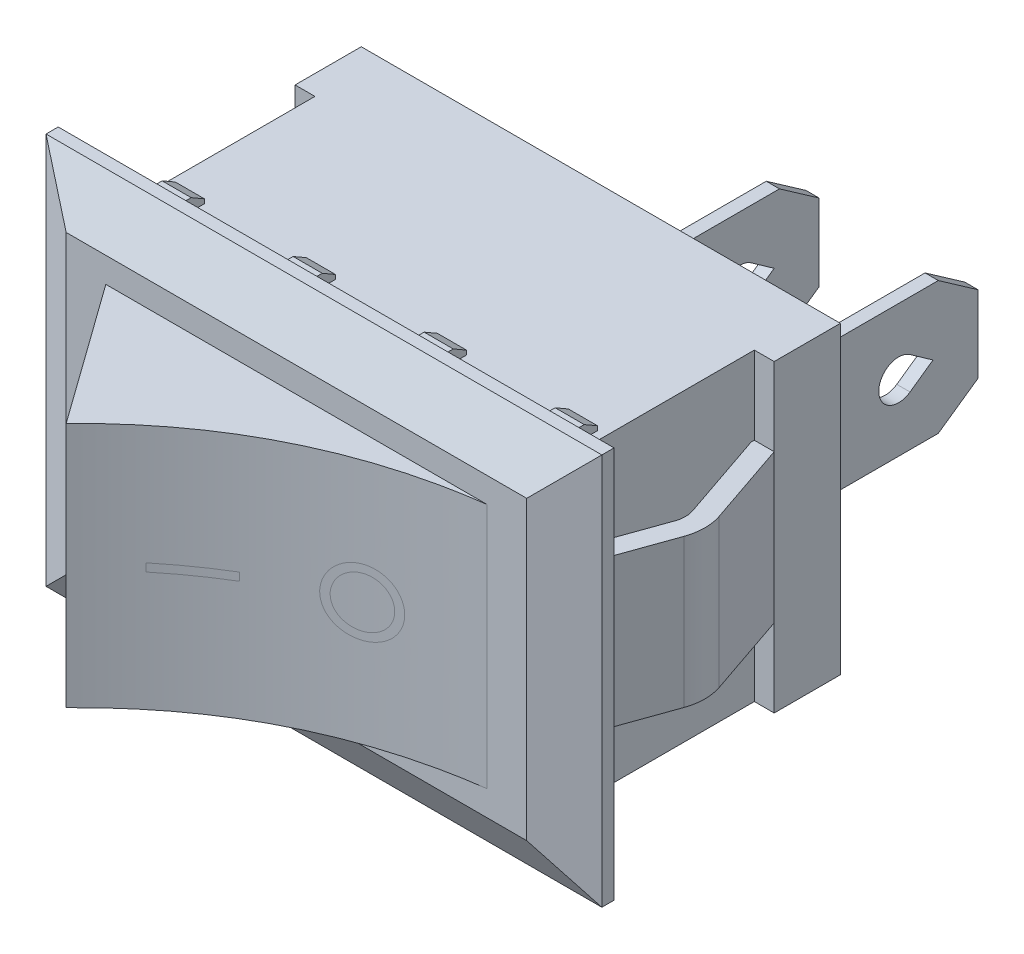
from build123d import *
from OCP.BRepFilletAPI import BRepFilletAPI_MakeChamfer

# Parameters (mm, degrees)
SKETCH1_W                       = 16.6
SKETCH1_H                       = 11.5
BOSS_EXTRUDE1_DEPTH             = 10
SKETCH2_W                       = 21
SKETCH2_H                       = 14.8
BOSS_EXTRUDE2_DEPTH             = 1.5
SKETCH3_W                       = 0.5
SKETCH3_H                       = 5
BOSS_EXTRUDE3_DEPTH             = 8
SKETCH4_W                       = 0.5
SKETCH4_H                       = 0.4
CUT_EXTRUDE1_DEPTH              = 22.623424798
BOSS_EXTRUDE4_REACH             = 19.241
SKETCH5_W                       = 0.75
SKETCH5_H                       = 2.5
BOSS_EXTRUDE4_DIRECTION_2_REACH = 19.241
BOSS_EXTRUDE5_DEPTH             = 2.8
BOSS_EXTRUDE5_DEPTH_BACK        = 2.8
CHAMFER1_SIZE                   = 1.8
CHAMFER1_SIZE2                  = 1.039230485
BOSS_EXTRUDE6_DEPTH             = 4.65
SKETCH9_W                       = 1.1
SKETCH9_H                       = 0.45
BOSS_EXTRUDE7_DEPTH             = 1.9
CHAMFER2_SIZE                   = 0.5
CHAMFER2_SIZE2                  = 0.288675135
SCALE2_SCALE                    = 0.7


with BuildPart() as part:
    # Sketch1 → Boss-Extrude1 (new body)
    with BuildSketch(Plane.XY):
        Rectangle(SKETCH1_W, SKETCH1_H)
    extrude(amount=BOSS_EXTRUDE1_DEPTH)

    # Sketch2 → Boss-Extrude2 (add)
    with BuildSketch(Plane.XY.offset(10)):
        Rectangle(SKETCH2_W, SKETCH2_H)
    extrude(amount=BOSS_EXTRUDE2_DEPTH)

    # Sketch3 → Boss-Extrude3 (add)
    with BuildSketch(Plane(origin=(0, 0, 0), x_dir=(-1, 0, 0), z_dir=(0, 0, -1))):
        with Locations((-6, 0)):
            Rectangle(SKETCH3_W, SKETCH3_H)
        Rectangle(SKETCH3_W, SKETCH3_H)
    extrude(amount=BOSS_EXTRUDE3_DEPTH)

    # Sketch4 → Cut-Extrude1 (cut, through all)
    with BuildSketch(Plane(origin=(6.25, 0, 0), x_dir=(0, 0, -1), z_dir=(1, 0, 0))):
        with Locations((2.25, 2.3)):
            Rectangle(SKETCH4_W, SKETCH4_H)
        with BuildLine():
            Line((0, 0.75), (0, -0.75))
            ThreePointArc((0, -0.75), (0.75, 0), (0, 0.75))
        make_face()
        Polygon((6.5, 2.5), (8, 1.449688693), (8, 2.5), align=None)
        with BuildLine():
            Line((5.432692308, 0.612598863), (6.3, 0))
            Line((6.3, 0), (5.432692308, -0.612598863))
            ThreePointArc((5.432692308, -0.612598863), (4.25, 0), (5.432692308, 0.612598863))
        make_face()
        Polygon((8, -2.5), (8, -1.449688693), (6.5, -2.5), align=None)
        with Locations((2.25, -2.3)):
            Rectangle(SKETCH4_W, SKETCH4_H)
    extrude(amount=-CUT_EXTRUDE1_DEPTH, mode=Mode.SUBTRACT)

    # Boss-Extrude4: up to this face of the body (flat: up to its plane)
    boss_extrude4_end = Plane(part.part.faces().sort_by_distance((0, 5.75, 5))[0])
    # Sketch5 → Boss-Extrude4 (add, up to the picked face)
    with BuildSketch(Plane(origin=(0, 0, 0), x_dir=(1, 0, 0), z_dir=(0, 1, 0)), mode=Mode.PRIVATE) as boss_extrude4_sk1:
        with Locations((-8.675, -1.25)):
            Rectangle(SKETCH5_W, SKETCH5_H)
    boss_extrude4_tool1 = split(extrude(boss_extrude4_sk1.sketch, amount=BOSS_EXTRUDE4_REACH, mode=Mode.PRIVATE), bisect_by=boss_extrude4_end, keep=Keep.BOTH, mode=Mode.PRIVATE)
    boss_extrude4 = boss_extrude4_tool1.solids().sort_by(Axis((-8.675, 0, 1.25), (0, 1, 0)))[0]
    add(boss_extrude4)

    # Boss-Extrude4 direction 2: up to this face of the body (flat: up to its plane)
    boss_extrude4_direction_2_end = Plane(part.part.faces().sort_by_distance((0, -5.75, 5))[0])
    # Sketch5 → Boss-Extrude4 direction 2 (add, up to the picked face)
    with BuildSketch(Plane(origin=(0, 0, 0), x_dir=(1, 0, 0), z_dir=(0, 1, 0)), mode=Mode.PRIVATE) as boss_extrude4_direction_2_sk1:
        with Locations((-8.675, -1.25)):
            Rectangle(SKETCH5_W, SKETCH5_H)
    boss_extrude4_direction_2_tool1 = split(extrude(boss_extrude4_direction_2_sk1.sketch, amount=-BOSS_EXTRUDE4_DIRECTION_2_REACH, mode=Mode.PRIVATE), bisect_by=boss_extrude4_direction_2_end, keep=Keep.BOTH, mode=Mode.PRIVATE)
    boss_extrude4_direction_2 = boss_extrude4_direction_2_tool1.solids().sort_by(Axis((-8.675, 0, 1.25), (0, -1, 0)))[0]
    add(boss_extrude4_direction_2)

    # Mirror1: Boss-Extrude4, Boss-Extrude4 direction 2 across plane
    add(boss_extrude4.mirror(Plane(origin=(0, 0, 0), x_dir=(0, 0, 1), z_dir=(1, 0, 0))))
    add(boss_extrude4_direction_2.mirror(Plane(origin=(0, 0, 0), x_dir=(0, 0, 1), z_dir=(1, 0, 0))))

    # Sketch6 → Boss-Extrude5 (add, two sides: drawn at the far end of the back side and taken through both)
    with BuildSketch(Plane(origin=(0, 0, 0), x_dir=(1, 0, 0), z_dir=(0, 1, 0)).offset(-BOSS_EXTRUDE5_DEPTH_BACK)):
        with BuildLine():
            Line((-9.05, -2.5), (-10.124907983, -5.653347952))
            ThreePointArc((-10.124907983, -5.653347952), (-10.231819447, -6.312838644), (-10.115557515, -6.970745323))
            Line((-10.115557515, -6.970745323), (-9.056614332, -9.938626949))
            Line((-9.056614332, -9.938626949), (-9.034716365, -10))
            Line((-9.034716365, -10), (-8.3, -10))
            Line((-8.3, -10), (-8.3, -9.827371619))
            Line((-8.3, -9.827371619), (-8.350231447, -9.686588817))
            Line((-8.350231447, -9.686588817), (-9.438479941, -6.636573707))
            ThreePointArc((-9.438479941, -6.636573707), (-9.496610907, -6.307620368), (-9.443155175, -5.977875022))
            Line((-9.443155175, -5.977875022), (-8.34011069, -2.741985882))
            Line((-8.34011069, -2.741985882), (-8.3, -2.624317241))
            Line((-8.3, -2.624317241), (-8.3, -2.5))
            Line((-8.3, -2.5), (-9.05, -2.5))
        make_face()
        with BuildLine():
            Line((8.3, -9.827371619), (8.350231447, -9.686588817))
            Line((8.350231447, -9.686588817), (9.438479941, -6.636573707))
            ThreePointArc((9.438479941, -6.636573707), (9.496610907, -6.307620368), (9.443155175, -5.977875022))
            Line((9.443155175, -5.977875022), (8.34011069, -2.741985882))
            Line((8.34011069, -2.741985882), (8.3, -2.624317241))
            Line((8.3, -2.624317241), (8.3, -2.5))
            Line((8.3, -2.5), (9.05, -2.5))
            Line((9.05, -2.5), (10.124907983, -5.653347952))
            ThreePointArc((10.124907983, -5.653347952), (10.231819447, -6.312838644), (10.115557515, -6.970745323))
            Line((10.115557515, -6.970745323), (9.056614332, -9.938626949))
            Line((9.056614332, -9.938626949), (9.034716365, -10))
            Line((9.034716365, -10), (8.3, -10))
            Line((8.3, -10), (8.3, -9.827371619))
        make_face()
    extrude(amount=BOSS_EXTRUDE5_DEPTH + BOSS_EXTRUDE5_DEPTH_BACK)

    # Chamfer1
    chamfer1_edges = [part.edges().sort_by_distance(p)[0] for p in [
        (10.5, 0, 11.5),
        (0, 7.4, 11.5),
        (-10.5, 0, 11.5),
        (0, -7.4, 11.5),
    ]]
    chamfer1_side = [part.faces().sort_by_distance(p)[0] for p in [
        (0, 0, 11.5),
    ]]
    chamfer(chamfer1_edges, length=CHAMFER1_SIZE, length2=CHAMFER1_SIZE2, reference=chamfer1_side[0])

    # Sketch7 → Boss-Extrude6 (add, symmetric)
    with BuildSketch(Plane(origin=(0, 0, 0), x_dir=(1, 0, 0), z_dir=(0, 1, 0))):
        with BuildLine():
            Line((-7.2, -11.5), (-3.398718251, -16.8))
            add(Edge.make_bspline(
                [(-3.398718251, -16.8), (0.927387699, -12.334784825), (7.2, -11.5)],
                knots=[0, 0, 0, 1, 1, 1], degree=2))
            Line((7.2, -11.5), (-7.2, -11.5))
        make_face()
    extrude(amount=BOSS_EXTRUDE6_DEPTH, both=True)

    # Sketch9 → Boss-Extrude7 (add)
    with BuildSketch(Plane(origin=(0, 0, 10), x_dir=(-1, 0, 0), z_dir=(0, 0, -1))):
        with Locations((-7.425, 5.975)):
            Rectangle(SKETCH9_W, SKETCH9_H)
        with Locations((-2.475, 5.975)):
            Rectangle(SKETCH9_W, SKETCH9_H)
        with Locations((2.475, 5.975)):
            Rectangle(SKETCH9_W, SKETCH9_H)
        with Locations((7.425, 5.975)):
            Rectangle(SKETCH9_W, SKETCH9_H)
        with Locations((7.425, -5.975)):
            Rectangle(SKETCH9_W, SKETCH9_H)
        with Locations((2.475, -5.975)):
            Rectangle(SKETCH9_W, SKETCH9_H)
        with Locations((-2.475, -5.975)):
            Rectangle(SKETCH9_W, SKETCH9_H)
        with Locations((-7.425, -5.975)):
            Rectangle(SKETCH9_W, SKETCH9_H)
    extrude(amount=BOSS_EXTRUDE7_DEPTH)

    # Chamfer2: one chamfer whose edges measure the first distance from different faces: ONE call of the kernel's chamfer builder (chamfer() names one face for all edges)
    chamfer2_edges_1 = [part.edges().sort_by_distance(p)[0] for p in [
        (7.425, 6.2, 8.1),
    ]]
    chamfer2_side_1 = [part.faces().sort_by_distance(p)[0] for p in [
        (7.425, 6.2, 9.05),
    ]]
    chamfer2_edges_2 = [part.edges().sort_by_distance(p)[0] for p in [
        (2.475, 6.2, 8.1),
    ]]
    chamfer2_side_2 = [part.faces().sort_by_distance(p)[0] for p in [
        (2.475, 6.2, 9.05),
    ]]
    chamfer2_edges_3 = [part.edges().sort_by_distance(p)[0] for p in [
        (-2.475, 6.2, 8.1),
    ]]
    chamfer2_side_3 = [part.faces().sort_by_distance(p)[0] for p in [
        (-2.475, 6.2, 9.05),
    ]]
    chamfer2_edges_4 = [part.edges().sort_by_distance(p)[0] for p in [
        (-7.425, 6.2, 8.1),
    ]]
    chamfer2_side_4 = [part.faces().sort_by_distance(p)[0] for p in [
        (-7.425, 6.2, 9.05),
    ]]
    chamfer2_edges_5 = [part.edges().sort_by_distance(p)[0] for p in [
        (-7.425, -6.2, 8.1),
    ]]
    chamfer2_side_5 = [part.faces().sort_by_distance(p)[0] for p in [
        (-7.425, -6.2, 9.05),
    ]]
    chamfer2_edges_6 = [part.edges().sort_by_distance(p)[0] for p in [
        (-2.475, -6.2, 8.1),
    ]]
    chamfer2_side_6 = [part.faces().sort_by_distance(p)[0] for p in [
        (-2.475, -6.2, 9.05),
    ]]
    chamfer2_edges_7 = [part.edges().sort_by_distance(p)[0] for p in [
        (2.475, -6.2, 8.1),
    ]]
    chamfer2_side_7 = [part.faces().sort_by_distance(p)[0] for p in [
        (2.475, -6.2, 9.05),
    ]]
    chamfer2_edges_8 = [part.edges().sort_by_distance(p)[0] for p in [
        (7.425, -6.2, 8.1),
    ]]
    chamfer2_side_8 = [part.faces().sort_by_distance(p)[0] for p in [
        (7.425, -6.2, 9.05),
    ]]
    chamfer2 = BRepFilletAPI_MakeChamfer(part.part.solid().wrapped)
    for e in chamfer2_edges_1:
        chamfer2.Add(CHAMFER2_SIZE, CHAMFER2_SIZE2, e.wrapped, chamfer2_side_1[0].wrapped)  # the first distance lies on this face
    for e in chamfer2_edges_2:
        chamfer2.Add(CHAMFER2_SIZE, CHAMFER2_SIZE2, e.wrapped, chamfer2_side_2[0].wrapped)  # the first distance lies on this face
    for e in chamfer2_edges_3:
        chamfer2.Add(CHAMFER2_SIZE, CHAMFER2_SIZE2, e.wrapped, chamfer2_side_3[0].wrapped)  # the first distance lies on this face
    for e in chamfer2_edges_4:
        chamfer2.Add(CHAMFER2_SIZE, CHAMFER2_SIZE2, e.wrapped, chamfer2_side_4[0].wrapped)  # the first distance lies on this face
    for e in chamfer2_edges_5:
        chamfer2.Add(CHAMFER2_SIZE, CHAMFER2_SIZE2, e.wrapped, chamfer2_side_5[0].wrapped)  # the first distance lies on this face
    for e in chamfer2_edges_6:
        chamfer2.Add(CHAMFER2_SIZE, CHAMFER2_SIZE2, e.wrapped, chamfer2_side_6[0].wrapped)  # the first distance lies on this face
    for e in chamfer2_edges_7:
        chamfer2.Add(CHAMFER2_SIZE, CHAMFER2_SIZE2, e.wrapped, chamfer2_side_7[0].wrapped)  # the first distance lies on this face
    for e in chamfer2_edges_8:
        chamfer2.Add(CHAMFER2_SIZE, CHAMFER2_SIZE2, e.wrapped, chamfer2_side_8[0].wrapped)  # the first distance lies on this face
    add(Compound.cast(chamfer2.Shape()), mode=Mode.REPLACE)


with BuildPart() as part_1:
    # Scale2: scaled about (-0.155191281, 0, 6.532138607)
    add(part.part.scale(SCALE2_SCALE).moved(Location((-0.046557384, 0, 1.959641582))))


solid = part_1.part
